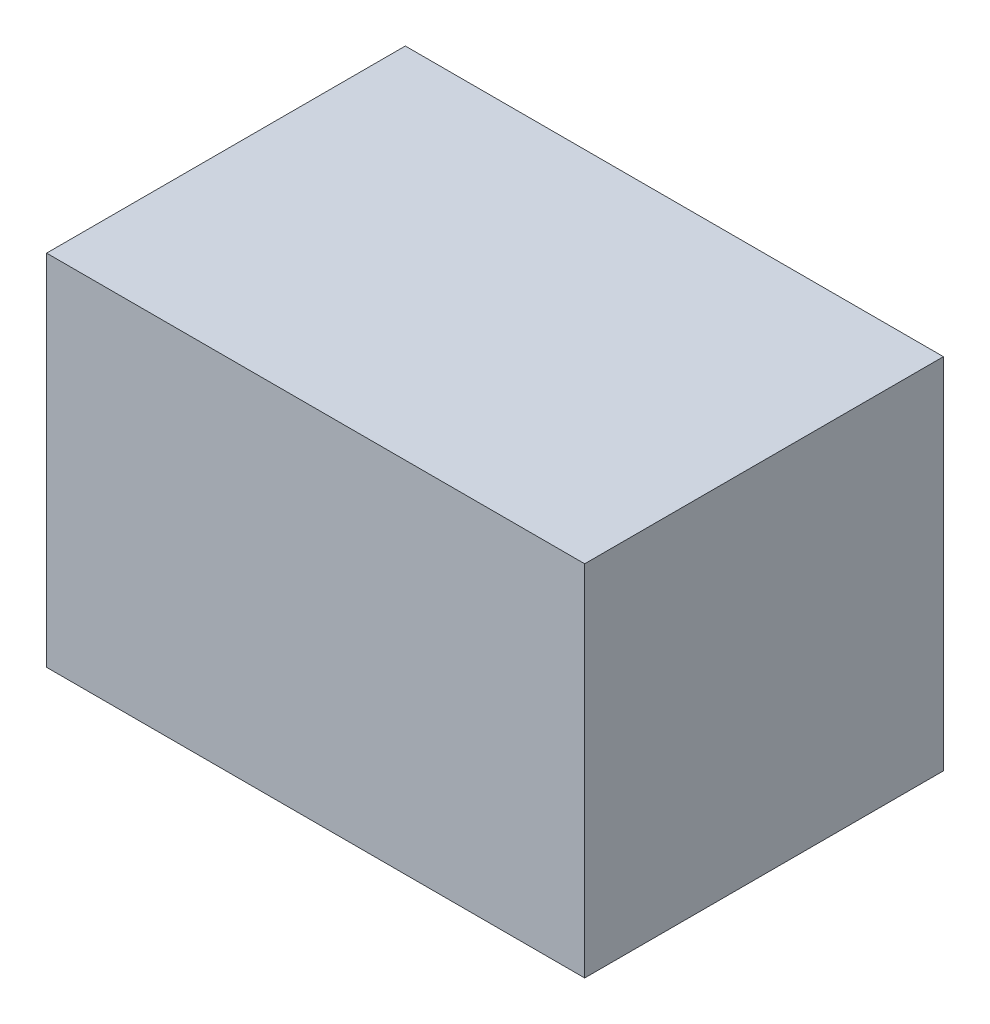
from build123d import *

# Parameters (mm, degrees)
SKETCH1_W           = 38.1
SKETCH1_H           = 38.1
BOSS_EXTRUDE1_DEPTH = 57.15


with BuildPart() as part:
    # Sketch1 → Boss-Extrude1 (new body)
    with BuildSketch(Plane(origin=(0, 0, 0), x_dir=(0, 0, -1), z_dir=(1, 0, 0))):
        with Locations((19.05, 19.05)):
            Rectangle(SKETCH1_W, SKETCH1_H)
    extrude(amount=BOSS_EXTRUDE1_DEPTH)


solid = part.part
